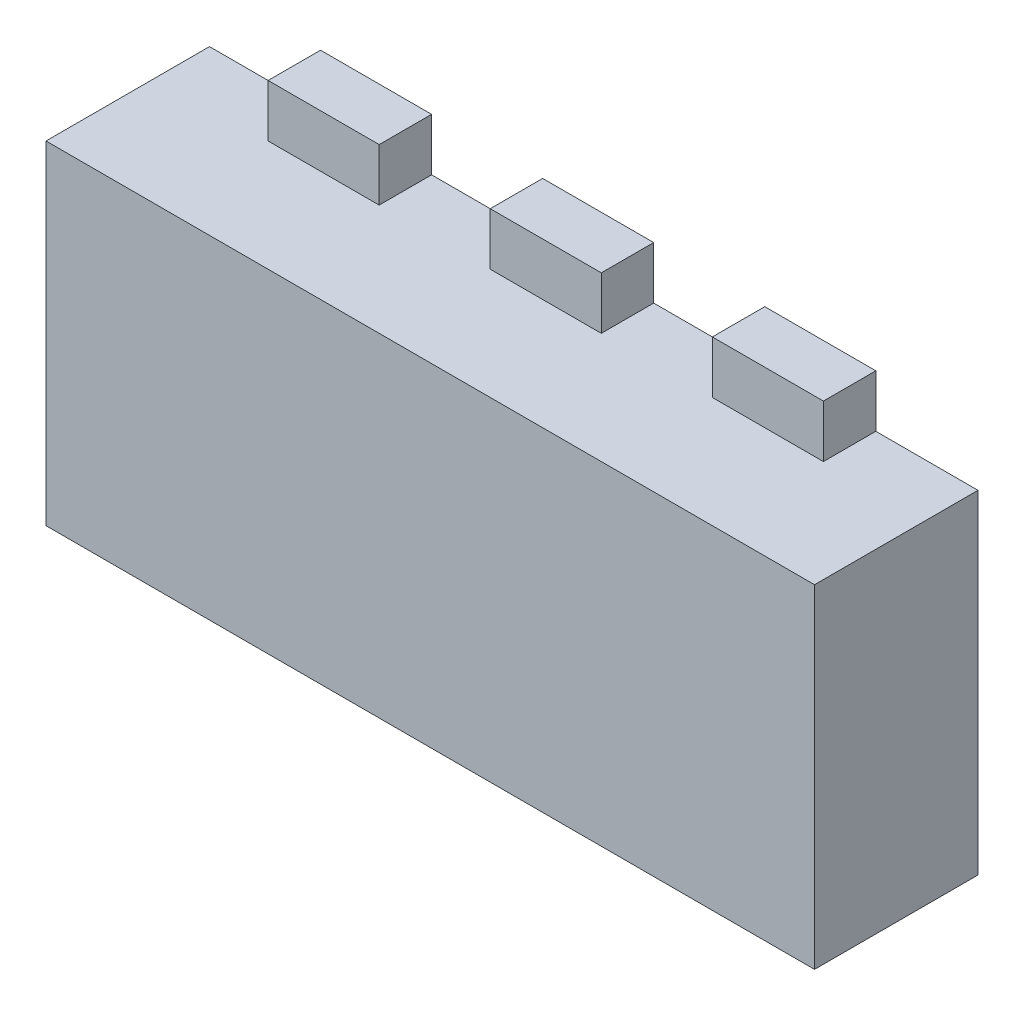
from build123d import *

# Parameters (mm, degrees)
SKETCH1_W               = 43.942
SKETCH1_H               = 19.05
BODY_DEPTH              = 2.9972
SKETCH2_W               = 6.35
SKETCH2_H               = 2.9972
TAB_DEPTH               = 2.9972
LPATTERN1_COUNT         = 3
LPATTERN1_PITCH         = 12.7
MIRROR1_COPY_1_SKETCH_W = 6.35
MIRROR1_COPY_1_SKETCH_H = 2.9972
MIRROR1_COPY_1_DEPTH    = 2.9972
MIRROR1_COPY_2_SKETCH_W = 6.35
MIRROR1_COPY_2_SKETCH_H = 2.9972
MIRROR1_COPY_2_DEPTH    = 2.9972
SKETCH5_W               = 43.942
SKETCH5_H               = 19.05
BOSS_EXTRUDE1_DEPTH     = 6.35


with BuildPart() as part:
    # Sketch1 → Body (new body)
    with BuildSketch(Plane.XY):
        Rectangle(SKETCH1_W, SKETCH1_H)
    extrude(amount=BODY_DEPTH)

    # Sketch2 → Tab (add)
    with BuildSketch(Plane(origin=(0, 9.525, 0), x_dir=(1, 0, 0), z_dir=(0, 1, 0))):
        with Locations((-12.446, -1.4986)):
            Rectangle(SKETCH2_W, SKETCH2_H)
    tab = extrude(amount=TAB_DEPTH)

    # LPattern1: Tab ×3
    with Locations(*[(i * LPATTERN1_PITCH, 0, 0) for i in range(1, LPATTERN1_COUNT)]):
        add(tab)

    # Mirror1: Tab across plane
    add(tab.mirror(Plane.ZX))

    # Mirror1 copy 1 sketch → Mirror1 copy 1 (add)
    with BuildSketch(Plane(origin=(12.7, -9.525, 0), x_dir=(1, 0, 0), z_dir=(0, -1, 0))):
        with Locations((-12.446, 1.4986)):
            Rectangle(MIRROR1_COPY_1_SKETCH_W, MIRROR1_COPY_1_SKETCH_H)
    extrude(amount=MIRROR1_COPY_1_DEPTH)

    # Mirror1 copy 2 sketch → Mirror1 copy 2 (add)
    with BuildSketch(Plane(origin=(25.4, -9.525, 0), x_dir=(1, 0, 0), z_dir=(0, -1, 0))):
        with Locations((-12.446, 1.4986)):
            Rectangle(MIRROR1_COPY_2_SKETCH_W, MIRROR1_COPY_2_SKETCH_H)
    extrude(amount=MIRROR1_COPY_2_DEPTH)

    # Sketch5 → Boss-Extrude1 (add)
    with BuildSketch(Plane.XY.offset(2.9972)):
        Rectangle(SKETCH5_W, SKETCH5_H)
    extrude(amount=BOSS_EXTRUDE1_DEPTH)


solid = part.part
